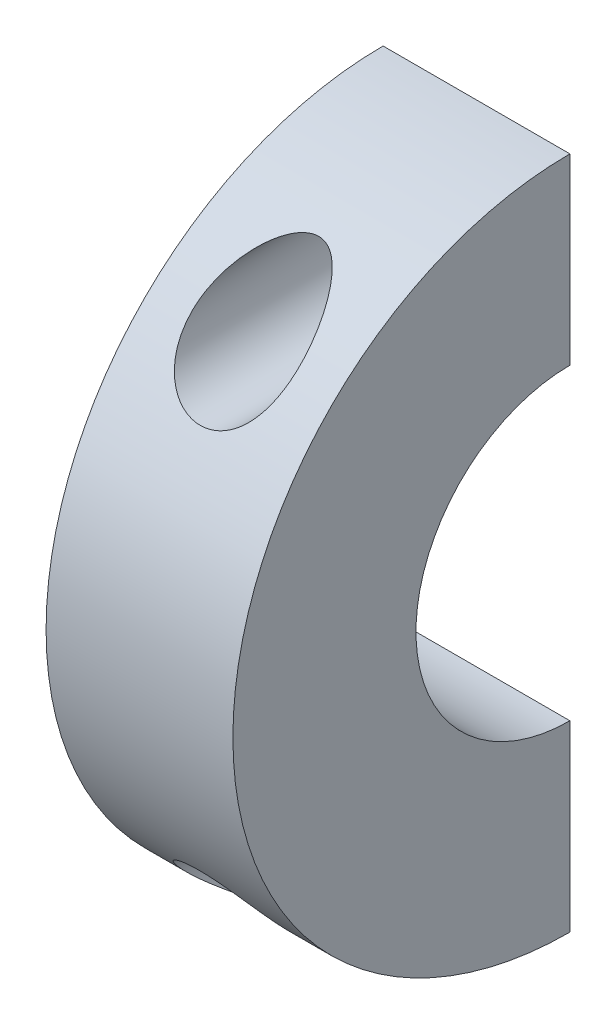
from build123d import *

# Parameters (mm, degrees)
REVOLVE1_ANGLE          = 180
CUT_EXTRUDE1_REACH      = 71.236
CUT_EXTRUDE1_END_RADIUS = 18.04
SKETCH2_R               = 2.8


with BuildPart() as part:
    # Sketch1 → Revolve1 (revolve)
    with BuildSketch(Plane.XY):
        Polygon((40.76425, 22.1), (36.125, 22.1), (36.125, 12.3), (46.125, 12.3), (46.125, 22.1), align=None)
    revolve(axis=Axis((53.3, 30.34, 0), (-1, 0, 0)), revolution_arc=REVOLVE1_ANGLE)

    # Cut-Extrude1: up to this cylinder (the profile starts inside it)
    cut_extrude1_end = Plane(origin=(41.125, 30.34, 0), z_dir=(1, 0, 0)) * Cylinder(CUT_EXTRUDE1_END_RADIUS, 179.552, mode=Mode.PRIVATE)
    # Sketch2 → Cut-Extrude1 (cut, up to the surface)
    with BuildSketch(Plane(origin=(0, 0, 0), x_dir=(-1, 0, 0), z_dir=(0, 0, -1)), mode=Mode.PRIVATE) as cut_extrude1_sk1:
        with Locations((-41.125, 43.48)):
            Circle(SKETCH2_R)
    cut_extrude1_tool1 = extrude(cut_extrude1_sk1.sketch, amount=-CUT_EXTRUDE1_REACH, mode=Mode.PRIVATE) & cut_extrude1_end
    add(cut_extrude1_tool1.solids().sort_by_distance((41.125, 43.48, 0))[0], mode=Mode.SUBTRACT)
    # Sketch2 → Cut-Extrude1 (cut, up to the surface)
    with BuildSketch(Plane(origin=(0, 0, 0), x_dir=(-1, 0, 0), z_dir=(0, 0, -1)), mode=Mode.PRIVATE) as cut_extrude1_sk2:
        with Locations((-41.125, 17.281263544)):
            Circle(SKETCH2_R)
    cut_extrude1_tool2 = extrude(cut_extrude1_sk2.sketch, amount=-CUT_EXTRUDE1_REACH, mode=Mode.PRIVATE) & cut_extrude1_end
    add(cut_extrude1_tool2.solids().sort_by_distance((41.125, 17.281264, 0))[0], mode=Mode.SUBTRACT)


solid = part.part
